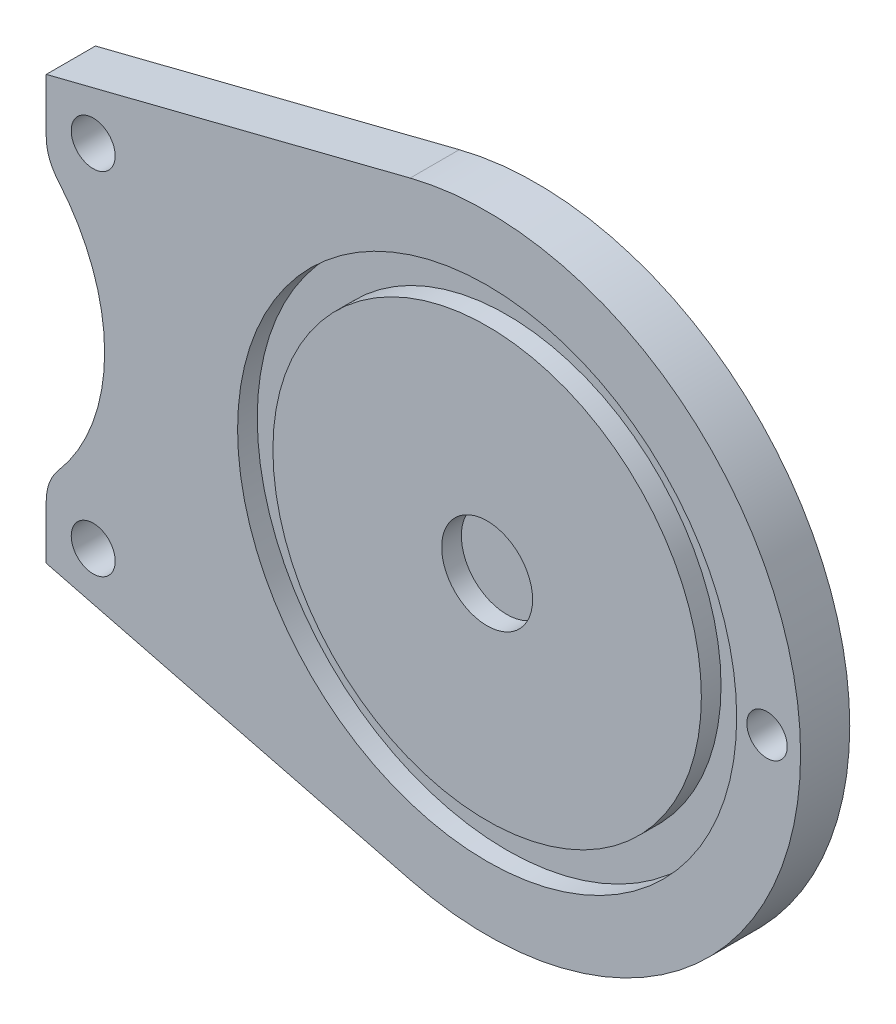
from build123d import *

# Parameters (mm, degrees)
EXTRUDE_1_DEPTH     = 10
SKETCH_2_R          = 4.468909074
SKETCH_2_R_2        = 4.108968286
CUT_EXTRUDE_1_DEPTH = 111.460779809
SKETCH_3_R          = 50.74720983
SKETCH_3_R_2        = 43.56554387
CUT_EXTRUDE_3_DEPTH = 4
SKETCH_4_R          = 9.24493497
CUT_EXTRUDE_4_DEPTH = 4
SKETCH_5_R          = 18.201318997
CUT_EXTRUDE_5_DEPTH = 5


with BuildPart() as part:
    # 草图1 → 凸台-拉伸1 (new body)
    with BuildSketch(Plane.XY):
        with BuildLine():
            Line((-89.657800503, -43.044325296), (-15.652055073, -61.790580648))
            ThreePointArc((-15.652055073, -61.790580648), (63.74215783, 0), (-15.652055073, 61.790580648))
            Line((-15.652055073, 61.790580648), (-89.657800503, 43.044325296))
            Line((-89.657800503, 43.044325296), (-89.657800503, 32.044242854))
            ThreePointArc((-89.657800503, 32.044242854), (-89.034636537, 28.569340555), (-87.242811306, 25.527525035))
            ThreePointArc((-87.242811306, 25.527525035), (-77.782727423, 0), (-87.242811306, -25.527525035))
            ThreePointArc((-87.242811306, -25.527525035), (-89.034636537, -28.569340555), (-89.657800503, -32.044242854))
            Line((-89.657800503, -32.044242854), (-89.657800503, -43.044325296))
        make_face()
    extrude(amount=EXTRUDE_1_DEPTH)

    # 草图2 → 切除-拉伸1 (cut, through all)
    with BuildSketch(Plane.XY.offset(10)):
        with Locations((-80.107707578, 35.677130973)):
            Circle(SKETCH_2_R)
        with Locations(Location((-80.107707578, -35.677130973, 0), (0, 0, 180))):
            Circle(SKETCH_2_R)
        with Locations((56.919679182, 0)):
            Circle(SKETCH_2_R_2)
    extrude(amount=-CUT_EXTRUDE_1_DEPTH, mode=Mode.SUBTRACT)

    # 草图3 → 切除-拉伸3 (cut)
    with BuildSketch(Plane.XY.offset(10)):
        Circle(SKETCH_3_R)
        Circle(SKETCH_3_R_2, mode=Mode.SUBTRACT)
    extrude(amount=-CUT_EXTRUDE_3_DEPTH, mode=Mode.SUBTRACT)

    # 草图4 → 切除-拉伸4 (cut)
    with BuildSketch(Plane.XY.offset(10)):
        Circle(SKETCH_4_R)
    extrude(amount=-CUT_EXTRUDE_4_DEPTH, mode=Mode.SUBTRACT)

    # 草图5 → 切除-拉伸5 (cut)
    with BuildSketch(Plane(origin=(0, 0, 0), x_dir=(-1, 0, 0), z_dir=(0, 0, -1))):
        Circle(SKETCH_5_R)
    extrude(amount=-CUT_EXTRUDE_5_DEPTH, mode=Mode.SUBTRACT)


solid = part.part
